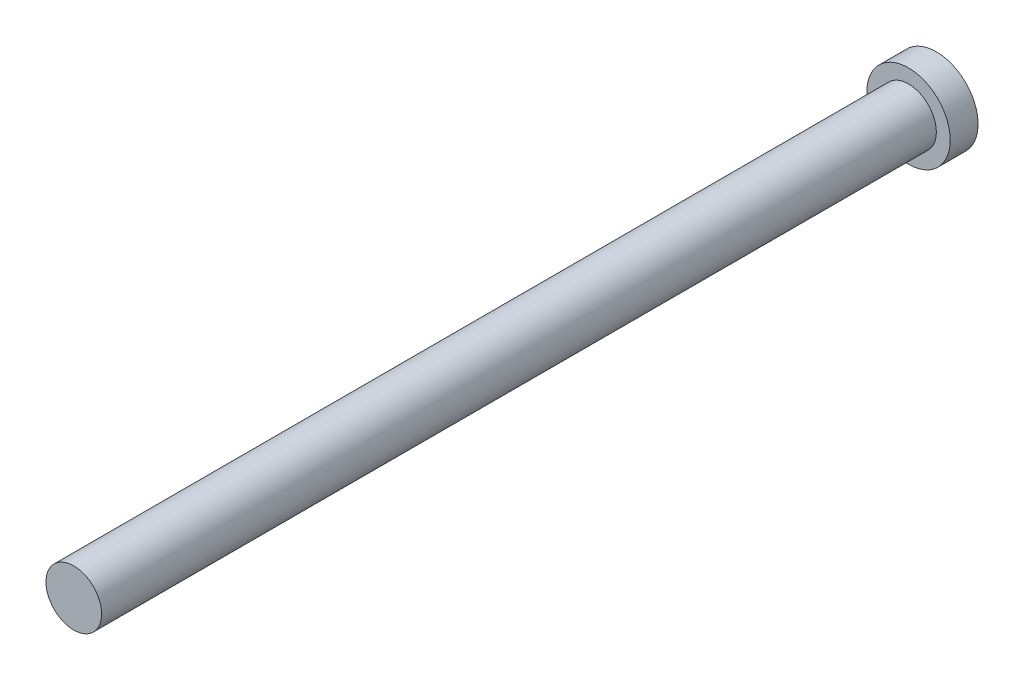
from build123d import *

# Parameters (mm, degrees)
SKETCH1_R           = 2
BOSS_EXTRUDE1_DEPTH = 60
SKETCH2_R           = 3
BOSS_EXTRUDE2_DEPTH = 2


with BuildPart() as part:
    # Sketch1 → Boss-Extrude1 (new body)
    with BuildSketch(Plane.XY):
        Circle(SKETCH1_R)
    extrude(amount=BOSS_EXTRUDE1_DEPTH)

    # Sketch2 → Boss-Extrude2 (add)
    with BuildSketch(Plane(origin=(0, 0, 0), x_dir=(-1, 0, 0), z_dir=(0, 0, -1))):
        Circle(SKETCH2_R)
    extrude(amount=BOSS_EXTRUDE2_DEPTH)


solid = part.part
